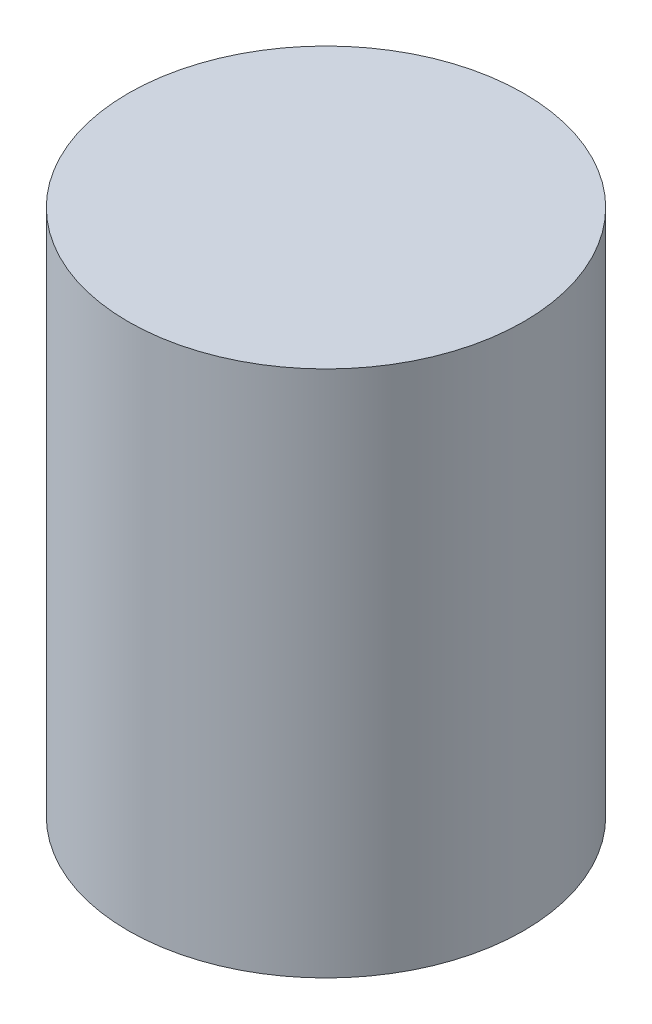
from build123d import *

# Parameters (mm, degrees)
SKETCH_1_W = 4.7625
SKETCH_1_H = 12.7


with BuildPart() as part:
    # 스케치1 → 회전1 (revolve)
    with BuildSketch(Plane.XY):
        with Locations((2.38125, 6.35)):
            Rectangle(SKETCH_1_W, SKETCH_1_H)
    revolve(axis=Axis((0, 12.7, 0), (0, -1, 0)))


solid = part.part
